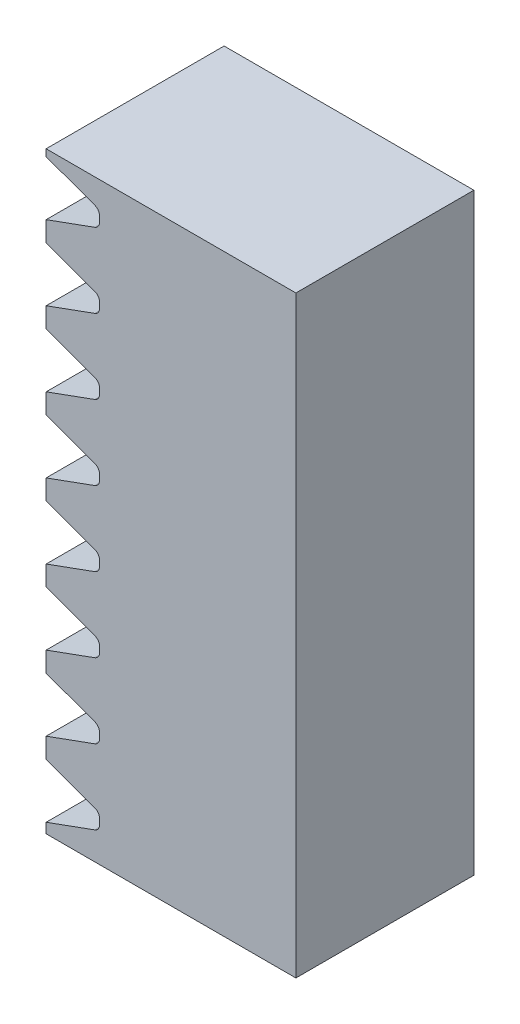
from build123d import *

# Parameters (mm, degrees)
CI_DEPTH                   = 7.5
CI_DEPTH_BACK              = 7.5
SKETCHCI_M_STRSKETCHNAME_W = 21.04999997
SKETCHCI_M_STRSKETCHNAME_H = 194.778741597
CUT_EXTRUDE_522_DEPTH      = 7.5
PATTERN_LINEAR_579_COUNT   = 31
PATTERN_LINEAR_579_PITCH   = 6.283185307
EXTRUDE3_DEPTH             = 194.164953792
EXTRUDE3_DEPTH_BACK        = 194.164953792


with BuildPart() as part:
    # SketchCI.m_strSketchName → 拉伸CI (new, two sides: drawn at the far end of the back side and taken through both)
    with BuildSketch(Plane.XY.offset(-CI_DEPTH_BACK)):
        with Locations((8.525000015, -94.247778193)):
            Rectangle(SKETCHCI_M_STRSKETCHNAME_W, SKETCHCI_M_STRSKETCHNAME_H)
    extrude(amount=CI_DEPTH + CI_DEPTH_BACK)

    # Sketch 415 → Cut-Extrude 522 (cut, symmetric)
    with BuildSketch(Plane.XY):
        with BuildLine():
            Line((-1.99999997, 2.298736761), (-1.99999997, -2.298736761))
            Line((-1.99999997, -2.298736761), (2.105212054, -0.804561779))
            ThreePointArc((2.105212054, -0.804561779), (2.391491191, -0.584892071), (2.499999962, -0.240746215))
            Line((2.499999962, -0.240746215), (2.499999962, 0.240746215))
            ThreePointArc((2.499999962, 0.240746215), (2.391491191, 0.584892071), (2.105212054, 0.804561779))
            Line((2.105212054, 0.804561779), (-1.99999997, 2.298736761))
        make_face()
    cut_extrude_522 = extrude(amount=CUT_EXTRUDE_522_DEPTH, both=True, mode=Mode.SUBTRACT)

    # Pattern Linear 579: Cut-Extrude 522 ×31
    with Locations(*[(0, -i * PATTERN_LINEAR_579_PITCH, 0) for i in range(1, PATTERN_LINEAR_579_COUNT)]):
        add(cut_extrude_522, mode=Mode.SUBTRACT)

    # Sketch4 → Extrude3 (cut, two sides: drawn at the far end of the back side and taken through both)
    with BuildSketch(Plane.XY.offset(7.5).offset(-EXTRUDE3_DEPTH_BACK)):
        Polygon((328.075571379, -141.637148991), (19.05, -141.637148991), (-18.275447969, -141.637148991), (-327.301019347, -141.637148991), (-327.301019347, 476.413993766), (328.075571379, 476.413993766), align=None)
    extrude(amount=EXTRUDE3_DEPTH + EXTRUDE3_DEPTH_BACK, mode=Mode.SUBTRACT)


solid = part.part
